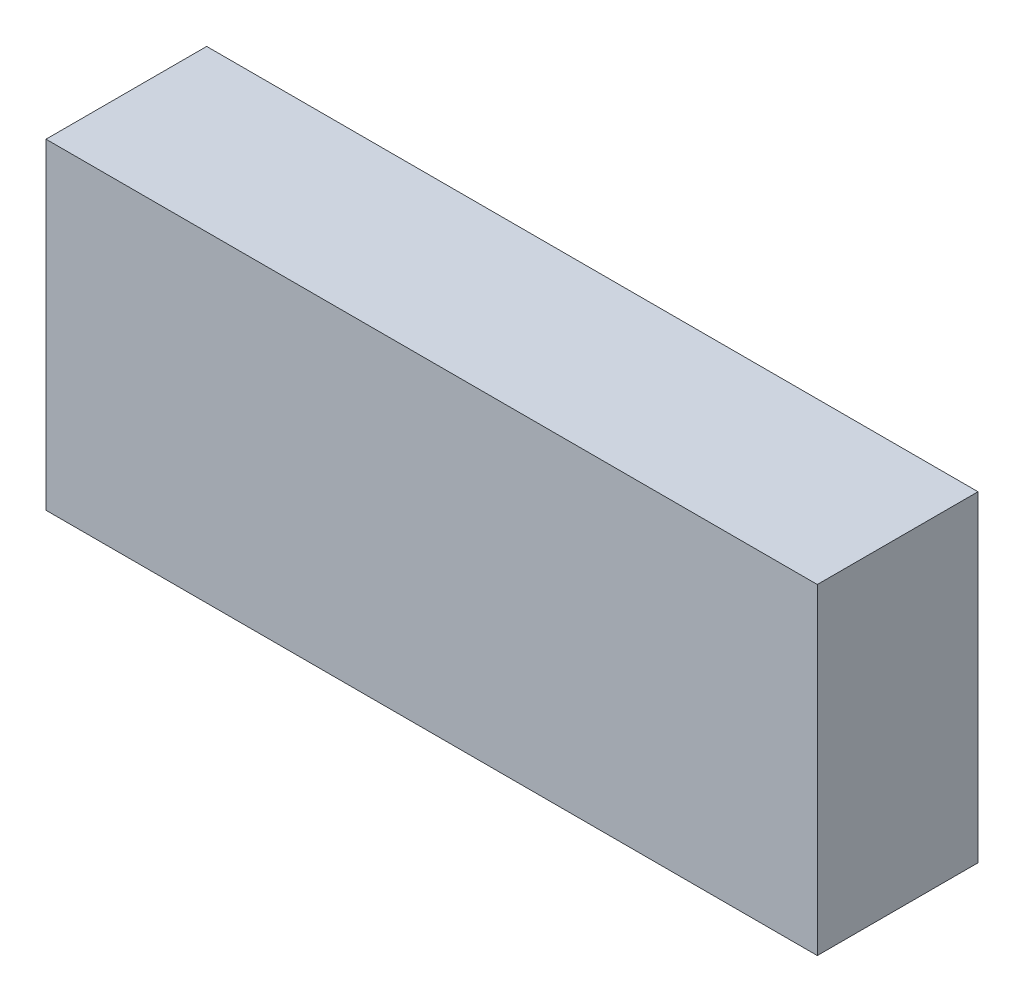
from build123d import *

# Parameters (mm, degrees)
SKETCH1_W           = 300
SKETCH1_H           = 125
BOSS_EXTRUDE1_DEPTH = 62.5


with BuildPart() as part:
    # Sketch1 → Boss-Extrude1 (new body)
    with BuildSketch(Plane.XY):
        with Locations((150, -62.5)):
            Rectangle(SKETCH1_W, SKETCH1_H)
    extrude(amount=BOSS_EXTRUDE1_DEPTH)


solid = part.part
